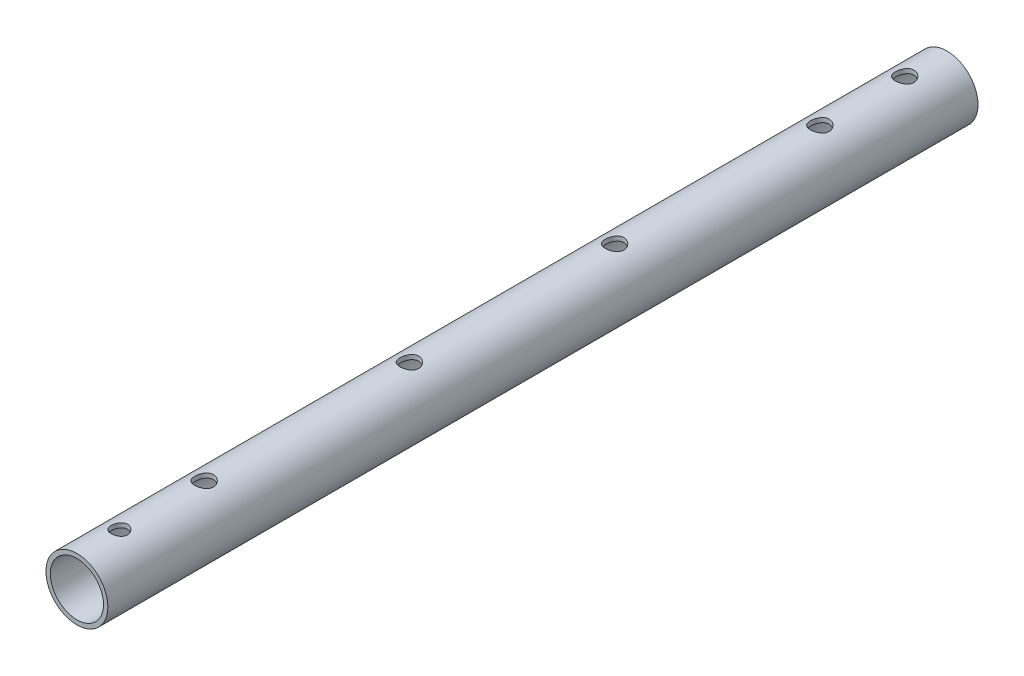
from build123d import *

# Parameters (mm, degrees)
SKETCH1_R               = 36.5
SKETCH1_R_2             = 31.34
BOSS_EXTRUDE1_DEPTH     = 1026
CUT_EXTRUDE1_DEPTH      = 1028.297668643
CUT_EXTRUDE1_DEPTH_BACK = 1028.297668643
SKETCH2_R               = 11
SKETCH2_R_2             = 9.623602105


with BuildPart() as part:
    # Sketch1 → Boss-Extrude1 (new body)
    with BuildSketch(Plane.XY):
        Circle(SKETCH1_R)
        Circle(SKETCH1_R_2, mode=Mode.SUBTRACT)
    extrude(amount=BOSS_EXTRUDE1_DEPTH)

    # Sketch2 → Cut-Extrude1 (cut, two sides: drawn at the far end of the back side and taken through both)
    with BuildSketch(Plane(origin=(0, 0, 0), x_dir=(1, 0, 0), z_dir=(0, 1, 0)).offset(-CUT_EXTRUDE1_DEPTH_BACK)):
        with Locations(Location((0, -50, 0), (0, 0, 270))):
            Circle(SKETCH2_R)
        with Locations(Location((0, -150, 0), (0, 0, 270))):
            Circle(SKETCH2_R)
        with Locations(Location((0, -392, 0), (0, 0, 270))):
            Circle(SKETCH2_R)
        with Locations(Location((0, -634, 0), (0, 0, 270))):
            Circle(SKETCH2_R)
        with Locations(Location((0, -876, 0), (0, 0, 270))):
            Circle(SKETCH2_R)
        with Locations(Location((0, -976, 0), (0, 0, 270))):
            Circle(SKETCH2_R_2)
    extrude(amount=CUT_EXTRUDE1_DEPTH + CUT_EXTRUDE1_DEPTH_BACK, mode=Mode.SUBTRACT)


solid = part.part
